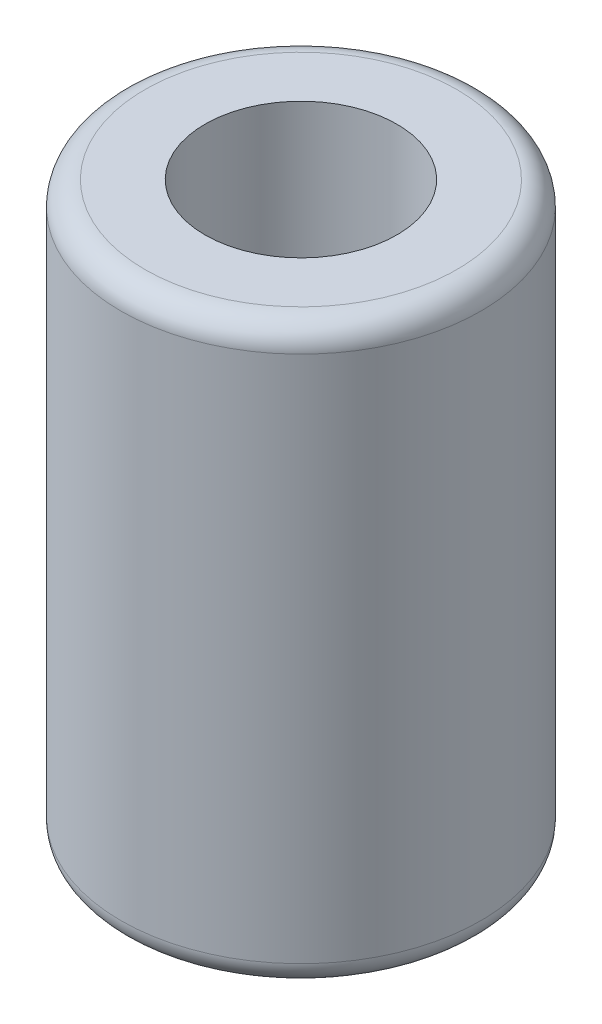
from build123d import *

# Parameters (mm, degrees)
BOSS_EXTRUDE1_DEPTH      = 12
BOSS_EXTRUDE1_DEPTH_BACK = 12
SKETCH1_R                = 7.5
SKETCH1_R_2              = 4
FILLET1_R                = 1


with BuildPart() as part:
    # Sketch1 → Boss-Extrude1 (new, two sides: drawn at the far end of the back side and taken through both)
    with BuildSketch(Plane(origin=(0, 0, 0), x_dir=(1, 0, 0), z_dir=(0, 1, 0)).offset(-BOSS_EXTRUDE1_DEPTH_BACK)):
        Circle(SKETCH1_R)
        Circle(SKETCH1_R_2, mode=Mode.SUBTRACT)
    extrude(amount=BOSS_EXTRUDE1_DEPTH + BOSS_EXTRUDE1_DEPTH_BACK)

    # Fillet1
    fillet1_edges = [part.edges().sort_by_distance(p)[0] for p in [
        (-7.5, -12, 0),
        (-7.5, 12, 0),
    ]]
    fillet(fillet1_edges, radius=FILLET1_R)


solid = part.part
